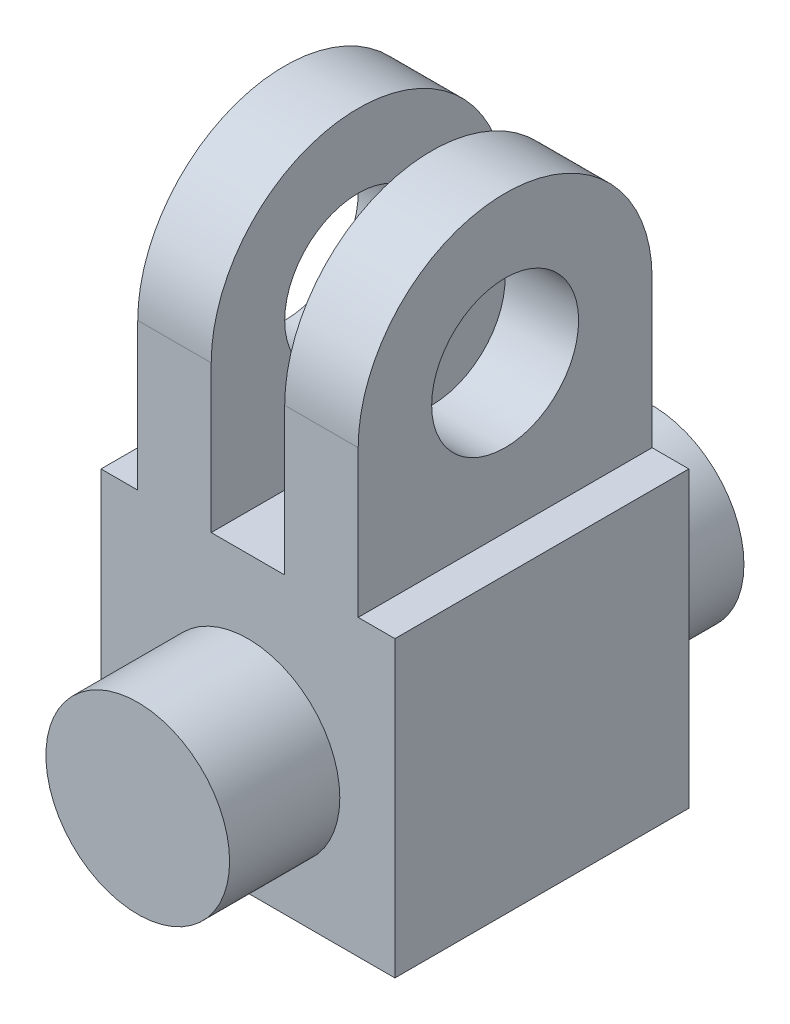
from build123d import *

# Parameters (mm, degrees)
CROQUIS1_R                   = 25
SALIENTE_EXTRUIR1_DEPTH      = 80
SALIENTE_EXTRUIR4_DEPTH      = 20
SALIENTE_EXTRUIR5_START      = -20
SALIENTE_EXTRUIR5_DEPTH      = 20
CROQUIS5_R                   = 20
CORTAR_EXTRUIR1_DEPTH        = 161.312195419
SALIENTE_EXTRUIR6_DEPTH      = 30
SALIENTE_EXTRUIR6_DEPTH_BACK = 110
CROQUIS6_R                   = 25


with BuildPart() as part:
    # Croquis1 → Saliente-Extruir1 (new body)
    with BuildSketch(Plane.XY):
        Polygon((40, -40), (-40, -40), (-40, 40), (-30, 40), (-30, 80), (-10, 80), (-10, 40), (10, 40), (10, 80), (30, 80), (30, 40), (40, 40), align=None)
        with Locations((0, -5)):
            Circle(CROQUIS1_R, mode=Mode.SUBTRACT)
    extrude(amount=-SALIENTE_EXTRUIR1_DEPTH)

    # Croquis2 → Saliente-Extruir4 (add)
    with BuildSketch(Plane(origin=(30, 0, 0), x_dir=(0, 0, -1), z_dir=(1, 0, 0))):
        with BuildLine():
            Line((80, 80), (0, 80))
            ThreePointArc((0, 80), (40, 120), (80, 80))
        make_face()
    extrude(amount=-SALIENTE_EXTRUIR4_DEPTH)

    # Croquis4 → Saliente-Extruir5 (add)
    with BuildSketch(Plane.ZY.offset(30).offset(SALIENTE_EXTRUIR5_START)):
        with BuildLine():
            Line((-80, 80), (0, 80))
            ThreePointArc((0, 80), (-40, 120), (-80, 80))
        make_face()
    extrude(amount=SALIENTE_EXTRUIR5_DEPTH)

    # Croquis5 → Cortar-Extruir1 (cut, through all)
    with BuildSketch(Plane.ZY.offset(30)):
        with Locations(Location((-40, 80, 0), (0, 0, 270))):
            Circle(CROQUIS5_R)
    extrude(amount=-CORTAR_EXTRUIR1_DEPTH, mode=Mode.SUBTRACT)

    # Croquis6 → Saliente-Extruir6 (add, two sides: drawn at the far end of the back side and taken through both)
    with BuildSketch(Plane.XY.offset(-SALIENTE_EXTRUIR6_DEPTH_BACK)):
        with Locations((0, -5)):
            Circle(CROQUIS6_R)
    extrude(amount=SALIENTE_EXTRUIR6_DEPTH + SALIENTE_EXTRUIR6_DEPTH_BACK)


solid = part.part
